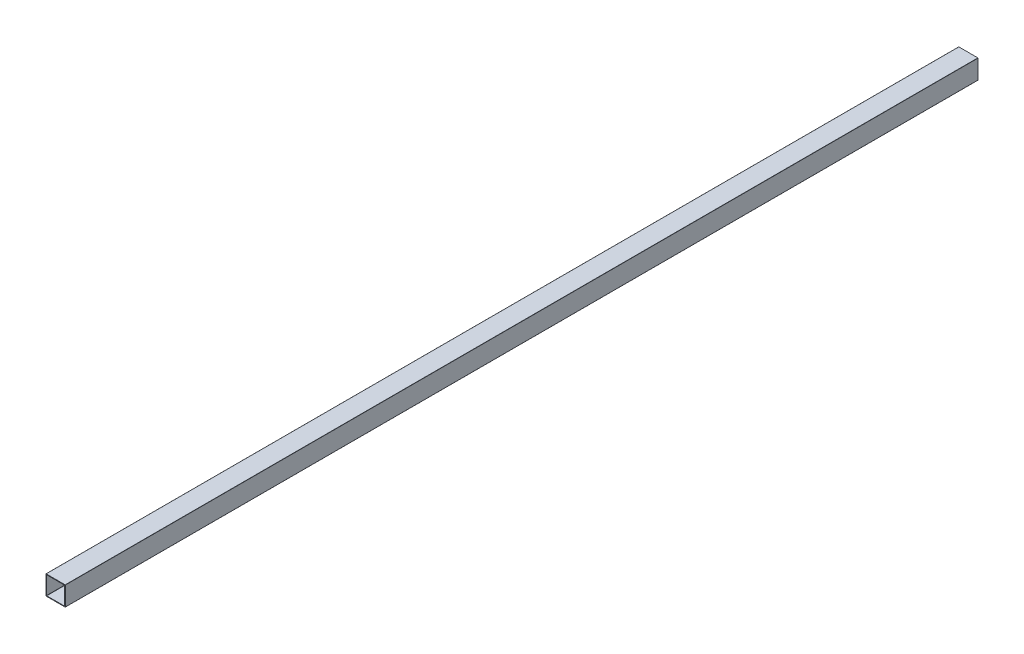
from build123d import *

# Parameters (mm, degrees)
CROQUIS1_W              = 127
CROQUIS1_H              = 127
CROQUIS1_W_2            = 119.4
CROQUIS1_H_2            = 119.4
SALIENTE_EXTRUIR1_DEPTH = 6000
REDONDEO1_R             = 1


with BuildPart() as part:
    # Croquis1 → Saliente-Extruir1 (new body)
    with BuildSketch(Plane.XY):
        Rectangle(CROQUIS1_W, CROQUIS1_H)
        Rectangle(CROQUIS1_W_2, CROQUIS1_H_2, mode=Mode.SUBTRACT)
    extrude(amount=-SALIENTE_EXTRUIR1_DEPTH)

    # Redondeo1
    redondeo1_edges = [part.edges().sort_by_distance(p)[0] for p in [
        (59.7, -59.7, -3000),
        (-59.7, -59.7, -3000),
        (-59.7, 59.7, -3000),
        (59.7, 59.7, -3000),
        (63.5, -63.5, -3000),
        (-63.5, -63.5, -3000),
        (-63.5, 63.5, -3000),
        (63.5, 63.5, -3000),
    ]]
    fillet(redondeo1_edges, radius=REDONDEO1_R)


solid = part.part
